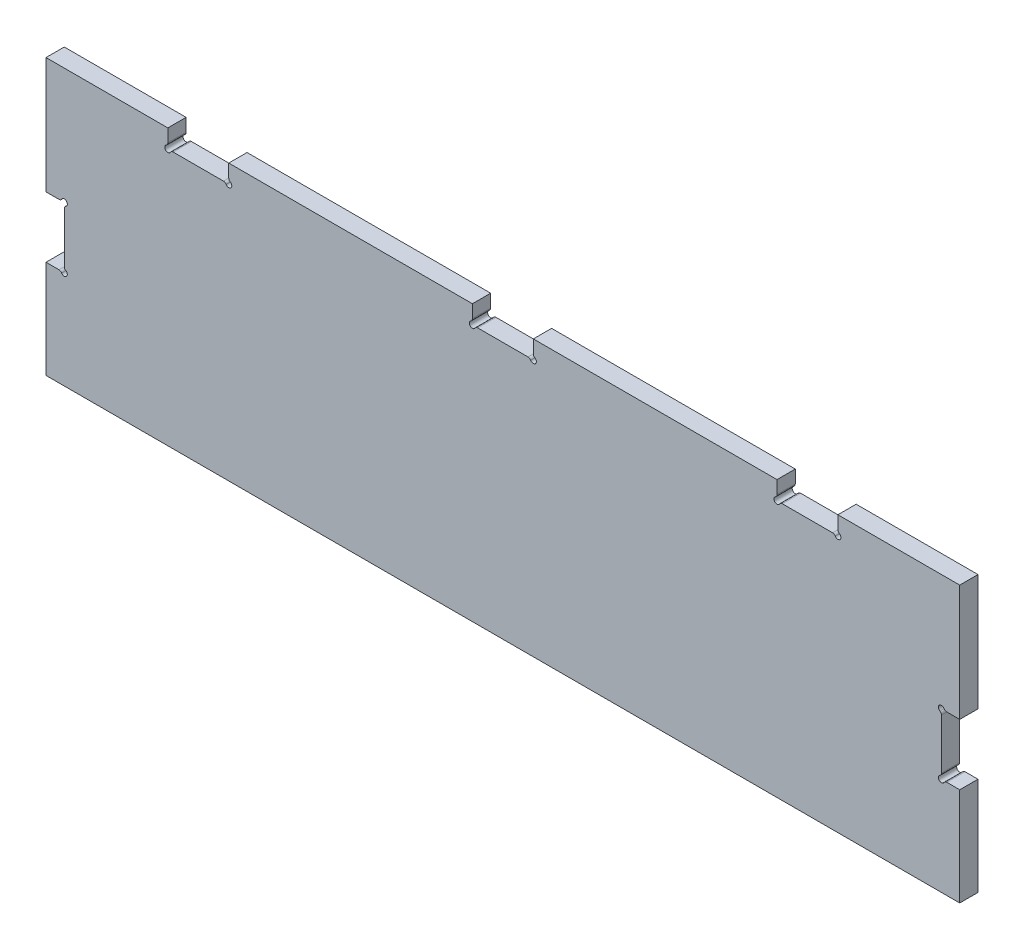
from build123d import *

# Parameters (mm, degrees)
BOSS_EXTRUDE1_DEPTH = 1.5
SKETCH2_R           = 0.5
CUT_EXTRUDE1_DEPTH  = 87.109465217
FILLET1_R           = 0.5


with BuildPart() as part:
    # Sketch1 → Boss-Extrude1 (new, symmetric)
    with BuildSketch(Plane.XY):
        Polygon((75, 3), (55, 3), (55, 0), (45, 0), (45, 3), (5, 3), (5, 0), (-5, 0), (-5, 3), (-45, 3), (-45, 0), (-55, 0), (-55, 3), (-75, 3), (-75, -16.1), (-72, -16.1), (-72, -26.1), (-75, -26.1), (-75, -42.2), (75, -42.2), (75, -26.1), (72, -26.1), (72, -16.1), (75, -16.1), align=None)
    extrude(amount=BOSS_EXTRUDE1_DEPTH, both=True)

    # Sketch2 → Cut-Extrude1 (cut, through all)
    with BuildSketch(Plane.XY.offset(1.5)):
        with Locations((-55, 0)):
            Circle(SKETCH2_R)
        with Locations((-72, -16.1)):
            Circle(SKETCH2_R)
        with Locations((-72, -26.1)):
            Circle(SKETCH2_R)
        with Locations((-45, 0)):
            Circle(SKETCH2_R)
        with Locations((-5, 0)):
            Circle(SKETCH2_R)
        with Locations((5, 0)):
            Circle(SKETCH2_R)
        with Locations((45, 0)):
            Circle(SKETCH2_R)
        with Locations((55, 0)):
            Circle(SKETCH2_R)
        with Locations((72, -16.1)):
            Circle(SKETCH2_R)
        with Locations((72, -26.1)):
            Circle(SKETCH2_R)
    extrude(amount=-CUT_EXTRUDE1_DEPTH, mode=Mode.SUBTRACT)

    # Fillet1
    fillet1_edges = [part.edges().sort_by_distance(p)[0] for p in [
        (-45, 0.5, 0),
        (-45.5, 0, 0),
        (-4.5, 0, 0),
        (-5, 0.5, 0),
        (5, 0.5, 0),
        (4.5, 0, 0),
        (45.5, 0, 0),
        (45, 0.5, 0),
        (55, 0.5, 0),
        (54.5, 0, 0),
        (72, -16.6, 0),
        (72.5, -16.1, 0),
        (72.5, -26.1, 0),
        (72, -25.6, 0),
        (-54.5, 0, 0),
        (-55, 0.5, 0),
        (-72.5, -16.1, 0),
        (-72, -16.6, 0),
        (-72, -25.6, 0),
        (-72.5, -26.1, 0),
    ]]
    fillet(fillet1_edges, radius=FILLET1_R)


solid = part.part
